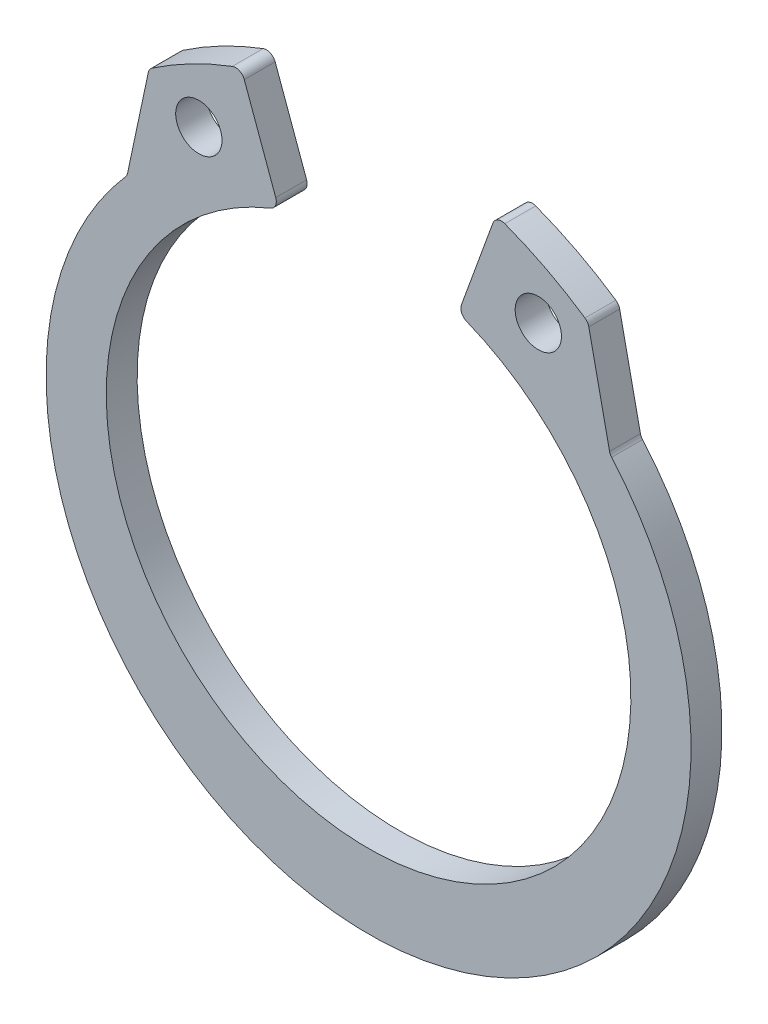
from build123d import *

# Parameters (mm, degrees)
ESQUISSE1_R      = 0.75
EXTRUSION1_DEPTH = 1


with BuildPart() as part:
    # Esquisse1 → Extrusion1 (new body)
    with BuildSketch(Plane.XY):
        with BuildLine():
            Line((-7.809424908, 6.552045147), (-7.137842505, 9.711591939))
            ThreePointArc((-7.137842505, 9.711591939), (-7.093293962, 9.816702497), (-7.012703099, 9.897559869))
            ThreePointArc((-7.012703099, 9.897559869), (-5.753680876, 10.647078732), (-4.415601587, 11.244120857))
            ThreePointArc((-4.415601587, 11.244120857), (-4.184471882, 11.23610854), (-4.027719362, 11.066068))
            Line((-4.027719362, 11.066068), (-3.008027786, 8.26448842))
            ThreePointArc((-3.008027786, 8.26448842), (-3.015921319, 8.039750525), (-3.177778678, 7.883636386))
            ThreePointArc((-3.177778678, 7.883636386), (0, -8.5), (3.177778678, 7.883636386))
            ThreePointArc((3.177778678, 7.883636386), (3.015921319, 8.039750525), (3.008027786, 8.26448842))
            Line((3.008027786, 8.26448842), (4.027719362, 11.066068))
            ThreePointArc((4.027719362, 11.066068), (4.184471882, 11.23610854), (4.415601587, 11.244120857))
            ThreePointArc((4.415601587, 11.244120857), (5.753680876, 10.647078732), (7.012703099, 9.897559869))
            ThreePointArc((7.012703099, 9.897559869), (7.093293962, 9.816702497), (7.137842505, 9.711591939))
            Line((7.137842505, 9.711591939), (7.809424908, 6.552045147))
            ThreePointArc((7.809424908, 6.552045147), (7.834486225, 6.480364242), (7.876742606, 6.417272087))
            ThreePointArc((7.876742606, 6.417272087), (0, -10.9), (-7.876742606, 6.417272087))
            ThreePointArc((-7.876742606, 6.417272087), (-7.834486225, 6.480364242), (-7.809424908, 6.552045147))
        make_face()
        with Locations((-5.5, 9)):
            Circle(ESQUISSE1_R, mode=Mode.SUBTRACT)
        with Locations((5.5, 9)):
            Circle(ESQUISSE1_R, mode=Mode.SUBTRACT)
    extrude(amount=EXTRUSION1_DEPTH)


solid = part.part
